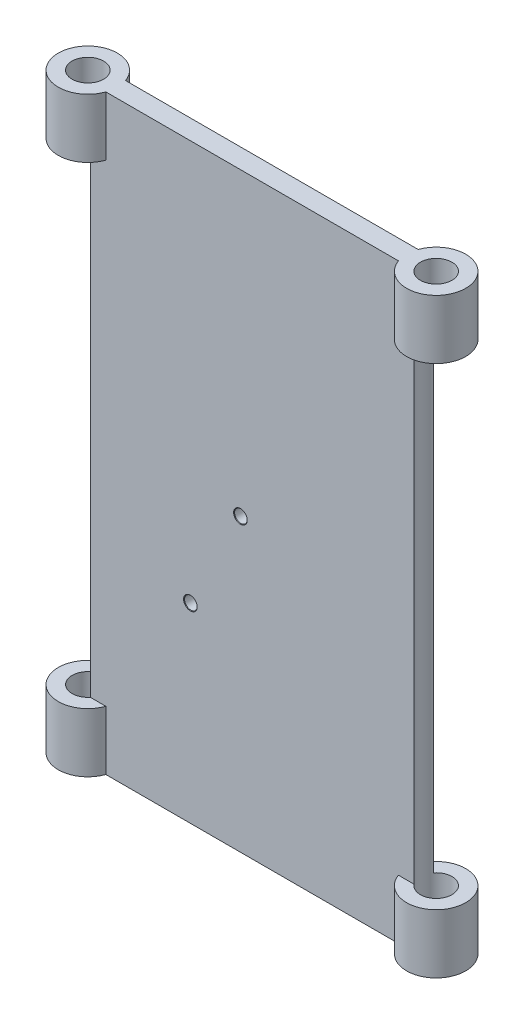
from build123d import *

# Parameters (mm, degrees)
SKETCH_1_W                   = 88.39
SKETCH_1_H                   = 150
EXTRUDE_1_DEPTH              = 5
SKETCH_2_R                   = 7.5
EXTRUDE_2_DEPTH              = 15
HOLE_WIZARD_1_D              = 8
EXTRUDE_3_DEPTH              = 15
SKETCH_8_R                   = 4
CUT_EXTRUDE_1_DEPTH          = 166.891205614
HOLE_WIZARD_M3_1_D           = 3.2
HOLE_WIZARD_M3_1_CSINK_D     = 3.45
HOLE_WIZARD_M3_1_CSINK_ANGLE = 90


with BuildPart() as part:
    # 스케치1 → 보스-돌출1 (new body)
    with BuildSketch(Plane.XY):
        with Locations((44.195, 75)):
            Rectangle(SKETCH_1_W, SKETCH_1_H)
    extrude(amount=EXTRUDE_1_DEPTH)

    # 스케치2 → 보스-돌출2 (add)
    with BuildSketch(Plane(origin=(0, 150, 0), x_dir=(1, 0, 0), z_dir=(0, 1, 0))):
        with Locations((88.39, -2.5)):
            Circle(SKETCH_2_R)
        with Locations((0, -2.5)):
            Circle(SKETCH_2_R)
    extrude(amount=-EXTRUDE_2_DEPTH)

    # 구멍1 (through all)
    with Locations(Plane(origin=(0, 150, 0), x_dir=(1, 0, 0), z_dir=(0, 1, 0))):
        with Locations((0, -2.5), (88.39, -2.5)):
            Hole(HOLE_WIZARD_1_D / 2)

    # 스케치7 → 보스-돌출3 (add)
    with BuildSketch(Plane.XZ):
        with BuildLine():
            Line((81.318932188, 0), (85.267501001, 0))
            ThreePointArc((85.267501001, 0), (84.39, 2.5), (85.267501001, 5))
            Line((85.267501001, 5), (81.318932188, 5))
            ThreePointArc((81.318932188, 5), (95.89, 2.5), (81.318932188, 0))
        make_face()
        with BuildLine():
            Line((3.122498999, 5), (7.071067812, 5))
            ThreePointArc((7.071067812, 5), (-7.5, 2.5), (7.071067812, 0))
            Line((7.071067812, 0), (3.122498999, 0))
            ThreePointArc((3.122498999, 0), (4, 2.5), (3.122498999, 5))
        make_face()
    extrude(amount=-EXTRUDE_3_DEPTH)

    # 스케치8 → 컷-돌출1 (cut, through all)
    with BuildSketch(Plane(origin=(0, 15, 0), x_dir=(1, 0, 0), z_dir=(0, 1, 0))):
        with Locations(Location((0, -2.5, 0), (0, 0, 270))):
            Circle(SKETCH_8_R)
        with Locations(Location((88.39, -2.5, 0), (0, 0, 270))):
            Circle(SKETCH_8_R)
    extrude(amount=-CUT_EXTRUDE_1_DEPTH, mode=Mode.SUBTRACT)

    # M3 여유 구멍1 (through all)
    with Locations(Plane.XY.offset(5)):
        with Locations((41.222498999, 73.8), (28.522498999, 48.4)):
            CounterSinkHole(HOLE_WIZARD_M3_1_D / 2, HOLE_WIZARD_M3_1_CSINK_D / 2, counter_sink_angle=HOLE_WIZARD_M3_1_CSINK_ANGLE)


solid = part.part
